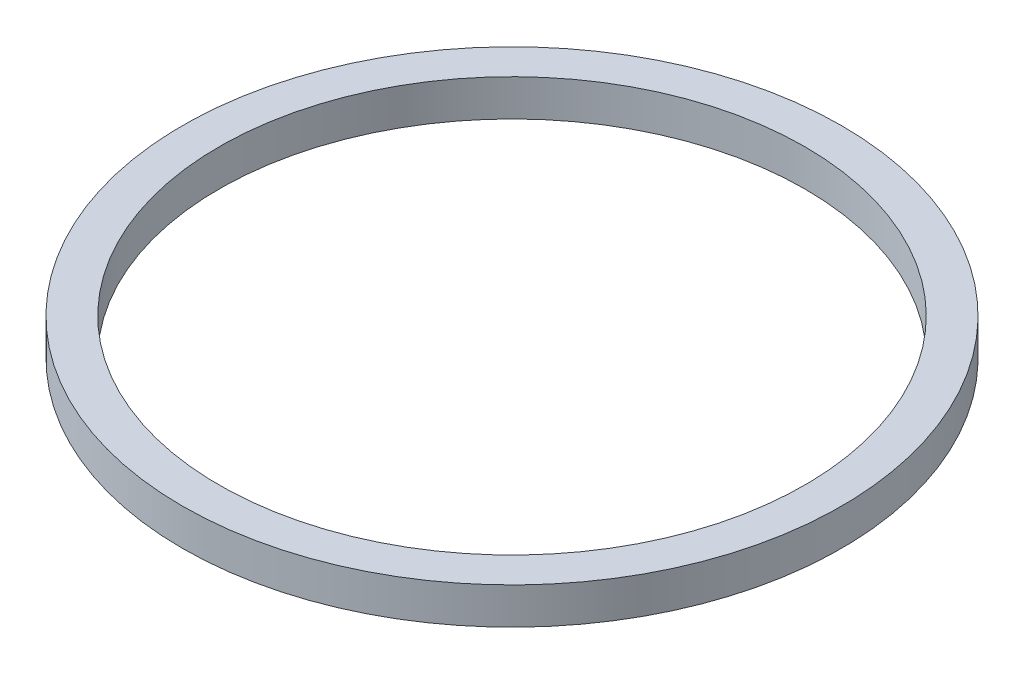
from build123d import *

# Parameters (mm, degrees)
SKETCH_1_R      = 171.45
SKETCH_1_R_2    = 152.4
EXTRUDE_1_DEPTH = 19.05


with BuildPart() as part:
    # 草图1 → 凸台-拉伸1 (new body)
    with BuildSketch(Plane(origin=(0, 0, 0), x_dir=(1, 0, 0), z_dir=(0, 1, 0))):
        with Locations(Location((0, 0, 0), (0, 0, 90))):
            Circle(SKETCH_1_R)
        with Locations(Location((0, 0, 0), (0, 0, 90))):
            Circle(SKETCH_1_R_2, mode=Mode.SUBTRACT)
    extrude(amount=EXTRUDE_1_DEPTH)


solid = part.part
